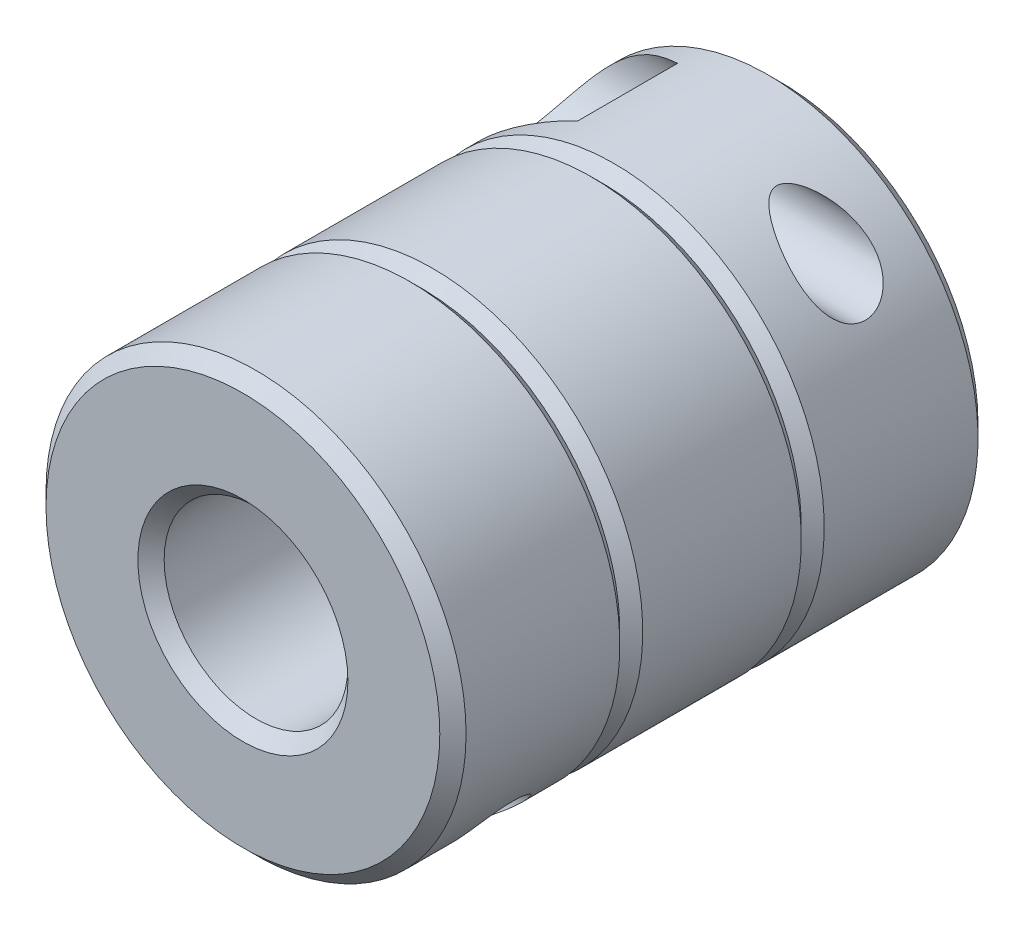
from build123d import *

# Parameters (mm, degrees)
HOLE_WIZARD_M5_1_D           = 5.5
HOLE_WIZARD_M5_1_DEPTH       = 30.416781825
HOLE_WIZARD_M5_1_CBORE_D     = 10
HOLE_WIZARD_M5_1_CBORE_DEPTH = 9.416781825
HOLE_WIZARD_M5_2_D           = 5.5
HOLE_WIZARD_M5_2_DEPTH       = 30.537541482
HOLE_WIZARD_M5_2_CBORE_D     = 10
HOLE_WIZARD_M5_2_CBORE_DEPTH = 9.537541482
HOLE_WIZARD_15_0_15_1_D      = 15
HOLE_WIZARD_15_0_15_1_DEPTH  = 20
HOLE_WIZARD_14_0_14_1_D      = 14
HOLE_WIZARD_14_0_14_1_DEPTH  = 20
CHAMFER_1_SIZE               = 1


with BuildPart() as part:
    # 草图1 → 旋转1 (revolve)
    with BuildSketch(Plane.XZ, mode=Mode.PRIVATE) as revolve_1_sk:
        Polygon((16, 41), (0, 41), (0, 0), (16, 0), (16, 12.716084229), (15.128119248, 13.587964981), (16, 14.459845733), (16, 26.540154267), (15.128119248, 27.412035019), (16, 28.283915771), align=None)
    revolve(revolve_1_sk.sketch.rotate(Axis((0, 0, 41), (0, 0, -1)), 180), axis=Axis((0, 0, 41), (0, 0, -1)))

    # M5 六角头螺栓的柱形沉头孔1
    with Locations(Plane.ZY.offset(14.416781825)):
        with Locations((6.680362699, 11.93948138)):
            CounterBoreHole(HOLE_WIZARD_M5_1_D / 2, HOLE_WIZARD_M5_1_CBORE_D / 2, HOLE_WIZARD_M5_1_CBORE_DEPTH, depth=HOLE_WIZARD_M5_1_DEPTH)

    # M5 六角头螺栓的柱形沉头孔2
    with Locations(Plane.ZY.offset(14.537541482)):
        with Locations((33.720086876, -11.682805373)):
            CounterBoreHole(HOLE_WIZARD_M5_2_D / 2, HOLE_WIZARD_M5_2_CBORE_D / 2, HOLE_WIZARD_M5_2_CBORE_DEPTH, depth=HOLE_WIZARD_M5_2_DEPTH)

    # Ø15.0 (15) 直径孔1
    with Locations(Plane(origin=(0, 0, 0), x_dir=(-1, 0, 0), z_dir=(0, 0, -1))):
        with Locations((0, 0)):
            Hole(HOLE_WIZARD_15_0_15_1_D / 2, depth=HOLE_WIZARD_15_0_15_1_DEPTH)

    # Ø14.0 (14) 直径孔1
    with Locations(Plane.XY.offset(41)):
        with Locations((0, 0)):
            Hole(HOLE_WIZARD_14_0_14_1_D / 2, depth=HOLE_WIZARD_14_0_14_1_DEPTH)

    # 倒角1
    chamfer_1_edges = [part.edges().sort_by_distance(p)[0] for p in [
        (16, 0, 0),
        (16, 0, 41),
        (-7.5, 0, 0),
        (7, 0, 41),
    ]]
    chamfer(chamfer_1_edges, length=CHAMFER_1_SIZE)


solid = part.part
